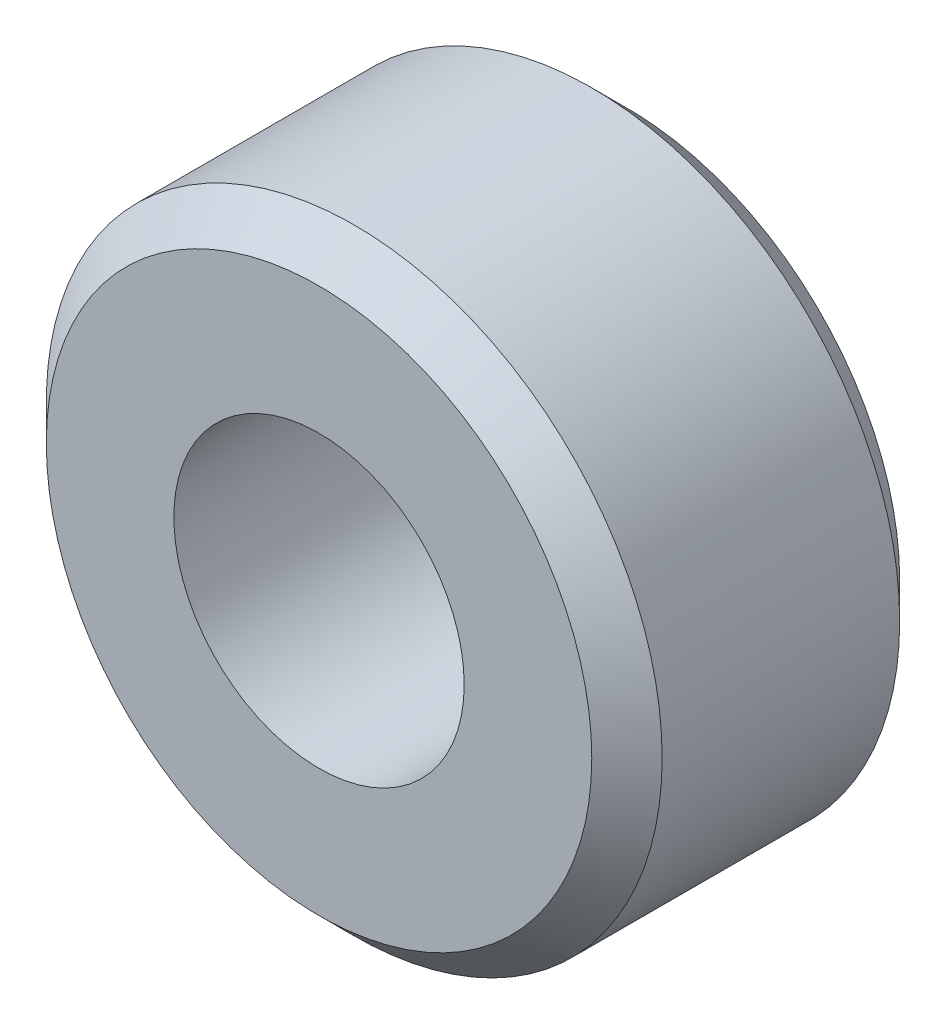
from build123d import *

# Parameters (mm, degrees)
SKETCH_1_R      = 3.5
SKETCH_1_R_2    = 1.65
EXTRUDE_1_DEPTH = 3.5
CHAMFER_1_SIZE  = 0.4


with BuildPart() as part:
    # 草图1 → 凸台-拉伸1 (new body)
    with BuildSketch(Plane.XY):
        Circle(SKETCH_1_R)
        Circle(SKETCH_1_R_2, mode=Mode.SUBTRACT)
    extrude(amount=EXTRUDE_1_DEPTH)

    # 倒角1
    chamfer_1_edges = [part.edges().sort_by_distance(p)[0] for p in [
        (-3.5, 0, 0),
        (-3.5, 0, 3.5),
    ]]
    chamfer(chamfer_1_edges, length=CHAMFER_1_SIZE)


solid = part.part
